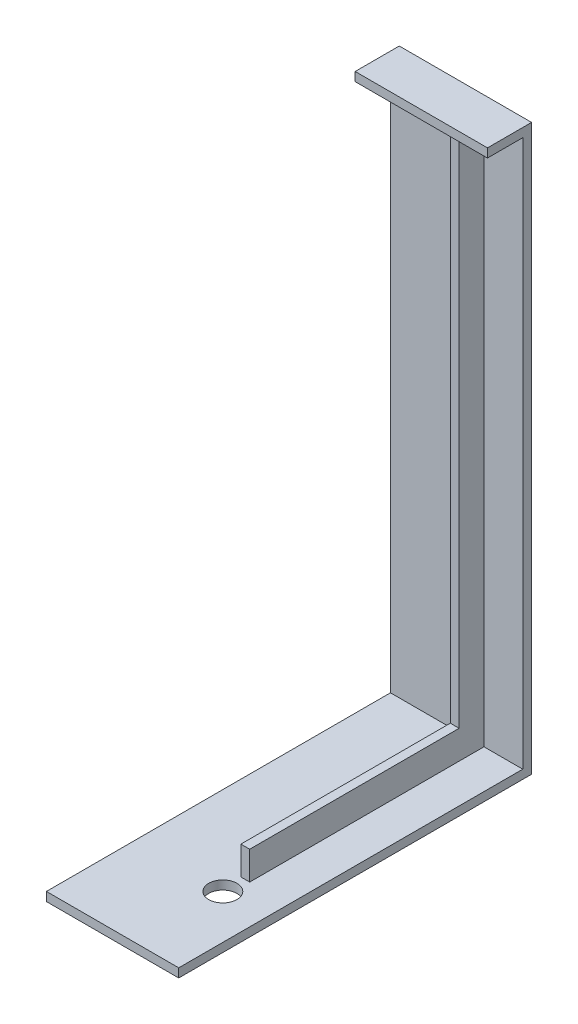
from build123d import *

# Parameters (mm, degrees)
SKETCH_1_W          = 15
SKETCH_1_H          = 64
EXTRUDE_1_DEPTH     = 40
SKETCH_2_W          = 30.056005851
SKETCH_2_H          = 62
CUT_EXTRUDE_1_DEPTH = 39
SKETCH_3_W          = 28.51308974
SKETCH_3_H          = 3.641282023
CUT_EXTRUDE_2_DEPTH = 35
SKETCH_4_R          = 1.6
CUT_EXTRUDE_3_DEPTH = 35
SKETCH_5_W          = 1
SKETCH_5_H          = 27.039604853
EXTRUDE_2_DEPTH     = 62
SKETCH_7_W          = 23.742414222
SKETCH_7_H          = 58.772442454
CUT_EXTRUDE_5_DEPTH = 62


with BuildPart() as part:
    # 草图1 → 凸台-拉伸1 (new body)
    with BuildSketch(Plane.XY):
        with Locations((7.5, 32)):
            Rectangle(SKETCH_1_W, SKETCH_1_H)
    extrude(amount=EXTRUDE_1_DEPTH)

    # 草图2 → 切除-拉伸1 (cut)
    with BuildSketch(Plane.XY.offset(40)):
        with Locations((11.079565378, 32)):
            Rectangle(SKETCH_2_W, SKETCH_2_H)
    extrude(amount=-CUT_EXTRUDE_1_DEPTH, mode=Mode.SUBTRACT)

    # 草图3 → 切除-拉伸2 (cut)
    with BuildSketch(Plane.XY.offset(40)):
        with Locations((10.369823967, 63.629780285)):
            Rectangle(SKETCH_3_W, SKETCH_3_H)
    extrude(amount=-CUT_EXTRUDE_2_DEPTH, mode=Mode.SUBTRACT)

    # 草图4 → 切除-拉伸3 (cut)
    with BuildSketch(Plane(origin=(0, 1, 0), x_dir=(1, 0, 0), z_dir=(0, 1, 0))):
        with Locations(Location((10, -30, 0), (0, 0, 270))):
            Circle(SKETCH_4_R)
    extrude(amount=-CUT_EXTRUDE_3_DEPTH, mode=Mode.SUBTRACT)

    # 草图5 → 凸台-拉伸2 (add)
    with BuildSketch(Plane(origin=(0, 1, 0), x_dir=(1, 0, 0), z_dir=(0, 1, 0))):
        with Locations((10.105118674, -14.040486519)):
            Rectangle(SKETCH_5_W, SKETCH_5_H)
    extrude(amount=EXTRUDE_2_DEPTH)

    # 草图7 → 切除-拉伸5 (cut)
    with BuildSketch(Plane(origin=(10.605118674, 0, 0), x_dir=(0, 0, -1), z_dir=(1, 0, 0))):
        with Locations((-15.689081835, 33.613778773)):
            Rectangle(SKETCH_7_W, SKETCH_7_H)
    extrude(amount=-CUT_EXTRUDE_5_DEPTH, mode=Mode.SUBTRACT)


solid = part.part
